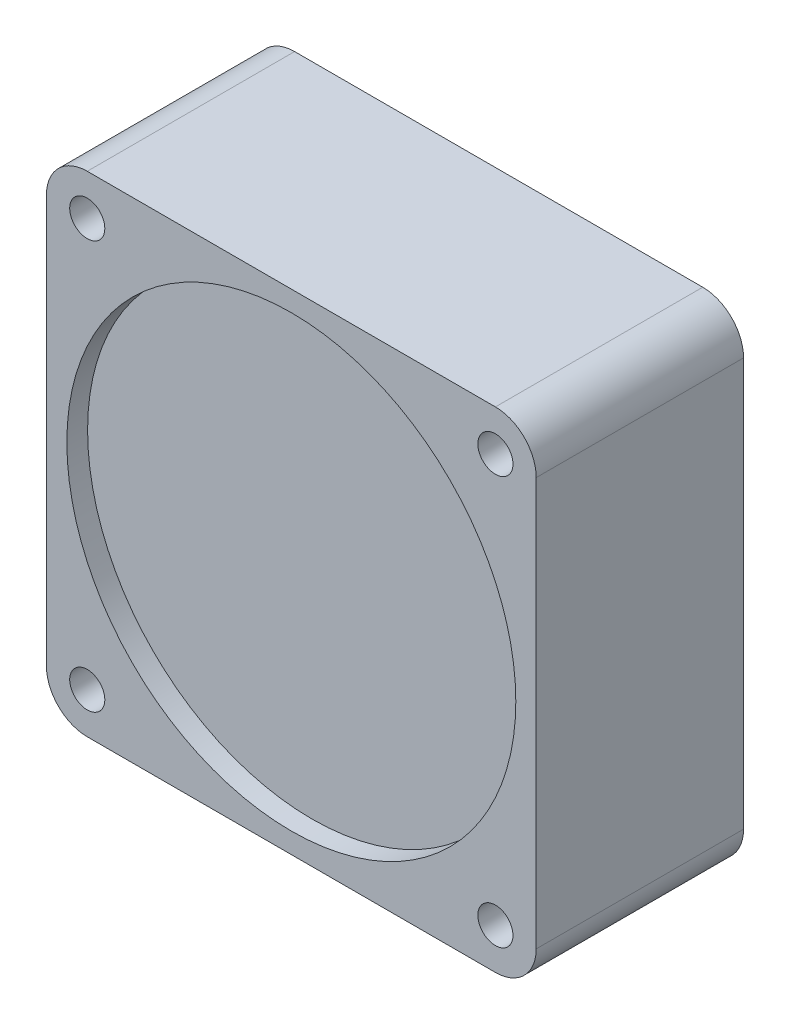
from build123d import *

# Parameters (mm, degrees)
SKETCH1_R           = 2.15
BOSS_EXTRUDE1_DEPTH = 25.4
SKETCH2_R           = 27.5
CUT_EXTRUDE1_DEPTH  = 2.54


with BuildPart() as part:
    # Sketch1 → Boss-Extrude1 (new body)
    with BuildSketch(Plane.XY):
        with BuildLine():
            Line((25.000000038, 30), (-25.000000038, 30))
            ThreePointArc((-25.000000038, 30), (-28.535533911, 28.535533885), (-30, 25))
            Line((-30, 25), (-30, -25))
            ThreePointArc((-30, -25), (-28.535533911, -28.535533885), (-25.000000038, -30))
            Line((-25.000000038, -30), (25.000000038, -30))
            ThreePointArc((25.000000038, -30), (28.535533944, -28.535533906), (30.000000038, -25))
            Line((30, -25), (30, 25))
            ThreePointArc((30, 25), (28.535533911, 28.535533885), (25.000000038, 30))
        make_face()
        with Locations((-25.000000038, -25)):
            Circle(SKETCH1_R, mode=Mode.SUBTRACT)
        with Locations((25.000000038, -25)):
            Circle(SKETCH1_R, mode=Mode.SUBTRACT)
        with Locations((-25.000000038, 25)):
            Circle(SKETCH1_R, mode=Mode.SUBTRACT)
        with Locations((25.000000038, 25)):
            Circle(SKETCH1_R, mode=Mode.SUBTRACT)
    extrude(amount=BOSS_EXTRUDE1_DEPTH)

    # Sketch2 → Cut-Extrude1 (cut)
    with BuildSketch(Plane.XY.offset(25.4)):
        Circle(SKETCH2_R)
    extrude(amount=-CUT_EXTRUDE1_DEPTH, mode=Mode.SUBTRACT)


solid = part.part
